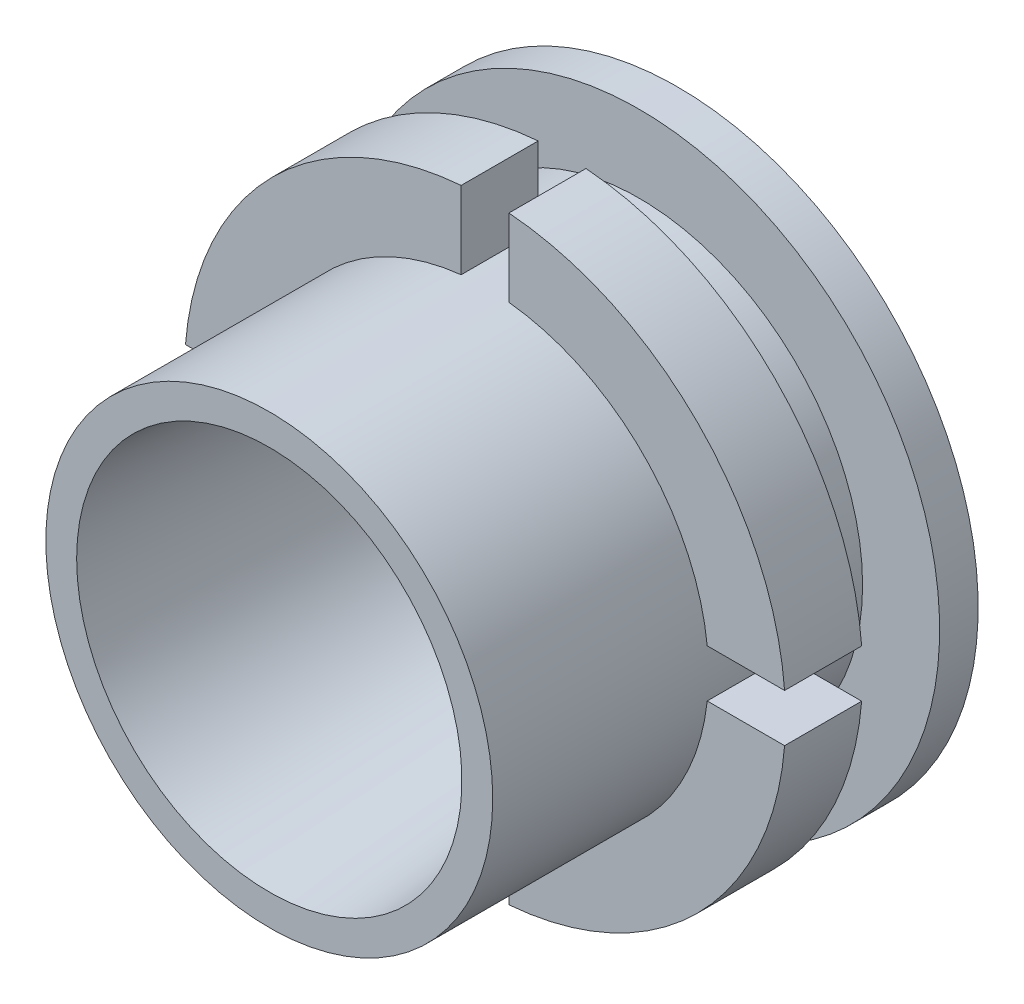
from build123d import *

# Parameters (mm, degrees)
SKETCH1_R                = 29
BOSS_EXTRUDE1_DEPTH      = 53
SKETCH2_R                = 25
CUT_EXTRUDE1_DEPTH       = 68.014923711
CUT_EXTRUDE1_TAPER       = 5
EXTRUDE_START            = -5
SKETCH_1_R               = 39
SKETCH_1_R_2             = 29
EXTRUDE_1_DEPTH          = 5
EXTRUDE_START_2          = -10
SKETCH_2_R               = 39
SKETCH_2_R_2             = 29
EXTRUDE_2_DEPTH          = 10
CUT_EXTRUDE_1_REACH      = 108.705
CUT_EXTRUDE_1_END_RADIUS = 29
SKETCH_3_W               = 6.2
SKETCH_3_H               = 20.212278325
PATTERN_CIRCULAR_1_COUNT = 4


with BuildPart() as part:
    # Sketch1 → Boss-Extrude1 (new body)
    with BuildSketch(Plane.XY):
        Circle(SKETCH1_R)
    extrude(amount=-BOSS_EXTRUDE1_DEPTH)

    # Sketch2 → Cut-Extrude1 (cut, through all)
    with BuildSketch(Plane(origin=(0, 0, 0), x_dir=(-1, 0, 0), z_dir=(0, 0, -1))):
        Circle(SKETCH2_R)
    extrude(amount=CUT_EXTRUDE1_DEPTH, taper=CUT_EXTRUDE1_TAPER, mode=Mode.SUBTRACT)

    # Sketch3 → Cut-Revolve1 (revolve, cut)
    with BuildSketch(Plane(origin=(0, 0, 0), x_dir=(0, 0, -1), z_dir=(1, 0, 0))):
        with BuildLine():
            Line((41.5, 22), (41.5, 20.5))
            Line((41.5, 20.5), (38.5, 20.5))
            Line((38.5, 20.5), (38.5, 22))
            ThreePointArc((38.5, 22), (40, 23.5), (41.5, 22))
        make_face()
    revolve(axis=Axis((0, 0, -33.171853518), (0, 0, 1)), mode=Mode.SUBTRACT)

    # Эскиз1 → Бобышка-Вытянуть1 (add)
    with BuildSketch(Plane(origin=(0, 0, -53), x_dir=(-1, 0, 0), z_dir=(0, 0, -1)).offset(EXTRUDE_START)):
        Circle(SKETCH_1_R)
        Circle(SKETCH_1_R_2, mode=Mode.SUBTRACT)
    extrude(amount=EXTRUDE_1_DEPTH)

    # Эскиз2 → Бобышка-Вытянуть2 (add)
    with BuildSketch(Plane(origin=(0, 0, -38), x_dir=(-1, 0, 0), z_dir=(0, 0, -1)).offset(EXTRUDE_START_2)):
        Circle(SKETCH_2_R)
        Circle(SKETCH_2_R_2, mode=Mode.SUBTRACT)
    extrude(amount=EXTRUDE_2_DEPTH)

    # Вырез-Вытянуть1: up to this cylinder (the profile starts outside it)
    cut_extrude_1_end = Plane(origin=(0, 0, -32.476974), z_dir=(0, 0, 1)) * Cylinder(CUT_EXTRUDE_1_END_RADIUS, 276.41, mode=Mode.PRIVATE)
    # Эскиз3 → Вырез-Вытянуть1 (cut, up to the surface)
    with BuildSketch(Plane(origin=(0, 45, 0), x_dir=(1, 0, 0), z_dir=(0, 1, 0)), mode=Mode.PRIVATE) as cut_extrude_1_sk1:
        with Locations((0, 32.47697446)):
            Rectangle(SKETCH_3_W, SKETCH_3_H)
    cut_extrude_1_tool1 = extrude(cut_extrude_1_sk1.sketch, amount=-CUT_EXTRUDE_1_REACH, mode=Mode.PRIVATE) - cut_extrude_1_end
    cut_extrude_1 = cut_extrude_1_tool1.solids().sort_by_distance((0, 45, -32.476974))[0]
    add(cut_extrude_1, mode=Mode.SUBTRACT)

    # Круговой массив1: Вырез-Вытянуть1 ×4 about axis
    pattern_circular_1_axis = Axis((0, 0, 0), (0, 0, 1))
    for i in range(1, PATTERN_CIRCULAR_1_COUNT):
        add(cut_extrude_1.rotate(pattern_circular_1_axis, i * 360 / PATTERN_CIRCULAR_1_COUNT), mode=Mode.SUBTRACT)


solid = part.part
